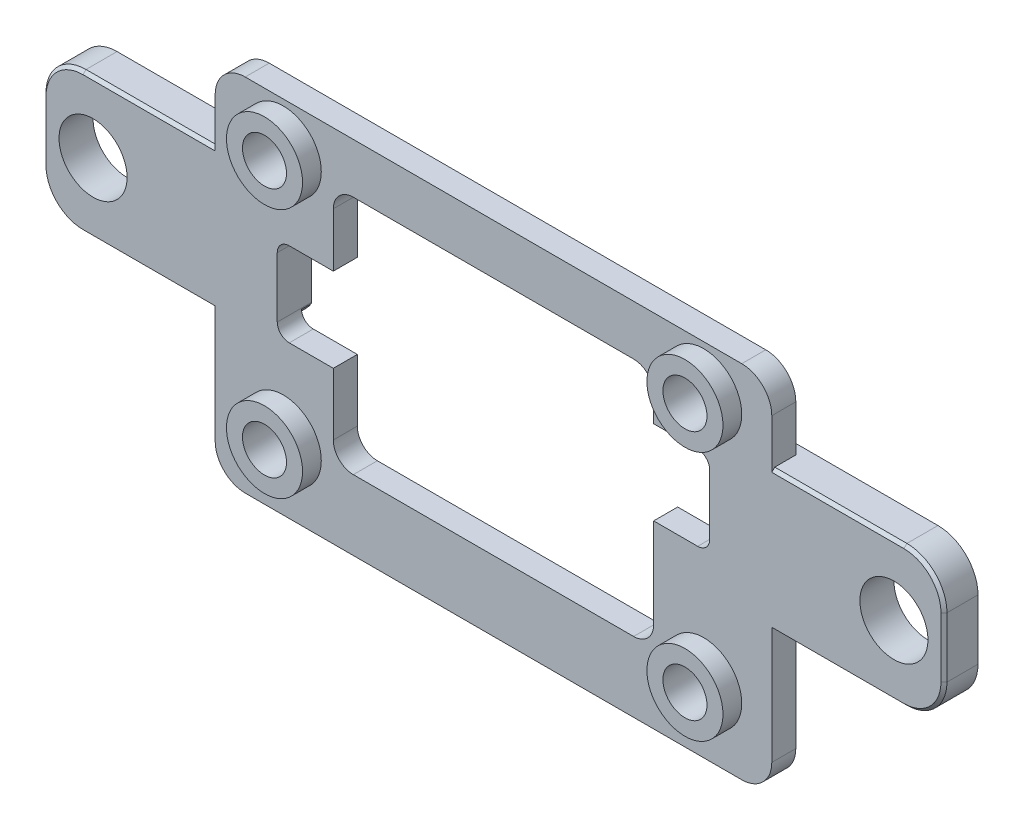
from build123d import *

# Parameters (mm, degrees)
EXTRUDE_START          = 0.5
EXTRUDE_0_5_1_2_DEPTH  = 1.2
EXTRUDE_1_7_DEPTH      = 1.7
EXTRUDE_START_2        = 1.7
SKETCH_721_R           = 1.9
EXTRUDE_774_DEPTH      = 0.9373
SKETCH_M2_R            = 1.1
CUT_EXTRUDE_907_DEPTH  = 28.562571565
SKETCH_M3_R            = 1.7
CUT_EXTRUDE_1008_DEPTH = 28.562571565
CUT_EXTRUDE_1244_DEPTH = 28.562571565
CHAMFER_C0_15_SIZE     = 0.15


with BuildPart() as part:
    # Sketch 220 → 托板抬高0_5并厚1_2 (new body)
    with BuildSketch(Plane.XY.offset(EXTRUDE_START)):
        with BuildLine():
            Line((-12.4, -15.7), (12.4, -15.7))
            ThreePointArc((12.4, -15.7), (13.460660172, -15.260660172), (13.9, -14.2))
            Line((13.9, -14.2), (13.9, 0.8))
            ThreePointArc((13.9, 0.8), (13.460660172, 1.860660172), (12.4, 2.3))
            Line((12.4, 2.3), (-12.4, 2.3))
            ThreePointArc((-12.4, 2.3), (-13.460660172, 1.860660172), (-13.9, 0.8))
            Line((-13.9, 0.8), (-13.9, -14.2))
            ThreePointArc((-13.9, -14.2), (-13.460660172, -15.260660172), (-12.4, -15.7))
        make_face()
        with BuildLine():
            Line((-7, -12.2), (7, -12.2))
            ThreePointArc((7, -12.2), (7.707106781, -11.907106781), (8, -11.2))
            Line((8, -11.2), (8, -1.2))
            ThreePointArc((8, -1.2), (7.707106781, -0.492893219), (7, -0.2))
            Line((7, -0.2), (-7, -0.2))
            ThreePointArc((-7, -0.2), (-7.707106781, -0.492893219), (-8, -1.2))
            Line((-8, -1.2), (-8, -11.2))
            ThreePointArc((-8, -11.2), (-7.707106781, -11.907106781), (-7, -12.2))
        make_face(mode=Mode.SUBTRACT)
    extrude(amount=EXTRUDE_0_5_1_2_DEPTH)

    # Sketch 459 → 安装耳底面基准与厚1_7 (add)
    with BuildSketch(Plane.XY):
        with BuildLine():
            Line((-20.5, -8.5), (-12.5, -8.5))
            ThreePointArc((-12.5, -8.5), (-11.085786438, -7.914213562), (-10.5, -6.5))
            Line((-10.5, -6.5), (-10.5, -3.5))
            ThreePointArc((-10.5, -3.5), (-11.085786438, -2.085786438), (-12.5, -1.5))
            Line((-12.5, -1.5), (-20.5, -1.5))
            ThreePointArc((-20.5, -1.5), (-21.914213562, -2.085786438), (-22.5, -3.5))
            Line((-22.5, -3.5), (-22.5, -6.5))
            ThreePointArc((-22.5, -6.5), (-21.914213562, -7.914213562), (-20.5, -8.5))
        make_face()
        with BuildLine():
            Line((12.5, -8.5), (20.5, -8.5))
            ThreePointArc((20.5, -8.5), (21.914213562, -7.914213562), (22.5, -6.5))
            Line((22.5, -6.5), (22.5, -3.5))
            ThreePointArc((22.5, -3.5), (21.914213562, -2.085786438), (20.5, -1.5))
            Line((20.5, -1.5), (12.5, -1.5))
            ThreePointArc((12.5, -1.5), (11.085786438, -2.085786438), (10.5, -3.5))
            Line((10.5, -3.5), (10.5, -6.5))
            ThreePointArc((10.5, -6.5), (11.085786438, -7.914213562), (12.5, -8.5))
        make_face()
    extrude(amount=EXTRUDE_1_7_DEPTH)

    # Sketch 721 → Extrude 774 (add)
    with BuildSketch(Plane.XY.offset(EXTRUDE_START_2)):
        with Locations((-10.5, -12.4)):
            Circle(SKETCH_721_R)
        with Locations((-10.5, 0.1)):
            Circle(SKETCH_721_R)
        with Locations((10.5, -12.4)):
            Circle(SKETCH_721_R)
        with Locations((10.5, 0.1)):
            Circle(SKETCH_721_R)
    extrude(amount=EXTRUDE_774_DEPTH)

    # 四个相机M2间隙孔 → Cut-Extrude 907 (cut, through all)
    with BuildSketch(Plane.XY):
        with Locations((-10.5, -12.4)):
            Circle(SKETCH_M2_R)
        with Locations((-10.5, 0.1)):
            Circle(SKETCH_M2_R)
        with Locations((10.5, -12.4)):
            Circle(SKETCH_M2_R)
        with Locations((10.5, 0.1)):
            Circle(SKETCH_M2_R)
    extrude(amount=CUT_EXTRUDE_907_DEPTH, mode=Mode.SUBTRACT)

    # 双耳M3间隙孔 → Cut-Extrude 1008 (cut, through all)
    with BuildSketch(Plane.XY):
        with Locations((-20, -5)):
            Circle(SKETCH_M3_R)
        with Locations((20, -5)):
            Circle(SKETCH_M3_R)
    extrude(amount=CUT_EXTRUDE_1008_DEPTH, mode=Mode.SUBTRACT)

    # Sketch 1078 → Cut-Extrude 1244 (cut, through all)
    with BuildSketch(Plane.XY):
        with BuildLine():
            Line((7.2, -6.7), (10.2, -6.7))
            ThreePointArc((10.2, -6.7), (10.624264069, -6.524264069), (10.8, -6.1))
            Line((10.8, -6.1), (10.8, -3.1))
            ThreePointArc((10.8, -3.1), (10.624264069, -2.675735931), (10.2, -2.5))
            Line((10.2, -2.5), (7.2, -2.5))
            ThreePointArc((7.2, -2.5), (6.775735931, -2.675735931), (6.6, -3.1))
            Line((6.6, -3.1), (6.6, -6.1))
            ThreePointArc((6.6, -6.1), (6.775735931, -6.524264069), (7.2, -6.7))
        make_face()
        with BuildLine():
            Line((-10.2, -8.1), (-7.2, -8.1))
            ThreePointArc((-7.2, -8.1), (-6.775735931, -7.924264069), (-6.6, -7.5))
            Line((-6.6, -7.5), (-6.6, -4.5))
            ThreePointArc((-6.6, -4.5), (-6.775735931, -4.075735931), (-7.2, -3.9))
            Line((-7.2, -3.9), (-10.2, -3.9))
            ThreePointArc((-10.2, -3.9), (-10.624264069, -4.075735931), (-10.8, -4.5))
            Line((-10.8, -4.5), (-10.8, -7.5))
            ThreePointArc((-10.8, -7.5), (-10.624264069, -7.924264069), (-10.2, -8.1))
        make_face()
    extrude(amount=CUT_EXTRUDE_1244_DEPTH, mode=Mode.SUBTRACT)

    # 安装耳外缘去锐C0_15
    chamfer_c0_15_edges = [part.edges().sort_by_distance(p)[0] for p in [
        (21.914213562, -2.085786438, 1.7),
        (22.5, -5, 1.7),
        (21.914213562, -7.914213562, 1.7),
        (-21.914213562, -7.914213562, 1.7),
        (-21.914213562, -2.085786438, 1.7),
        (-22.5, -5, 1.7),
    ]]
    chamfer(chamfer_c0_15_edges, length=CHAMFER_C0_15_SIZE)


solid = part.part
